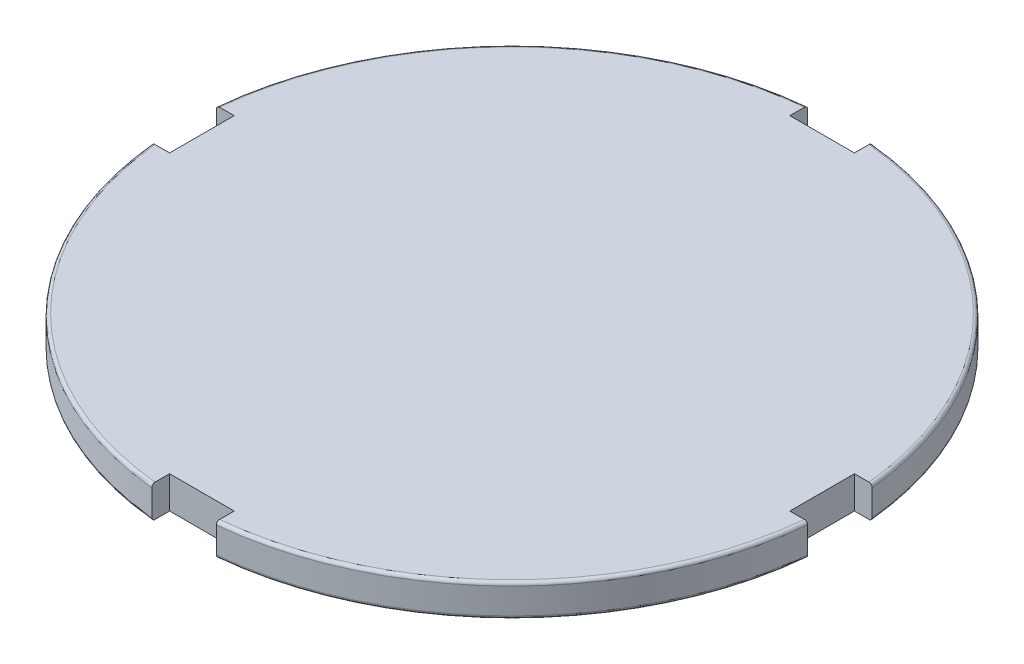
from build123d import *

# Parameters (mm, degrees)
SKETCH2_R           = 64.77
BOSS_EXTRUDE1_DEPTH = 6.35
FILLET1_R           = 0.635
SKETCH4_W           = 13.950963387
SKETCH4_H           = 12.7
SKETCH4_W_2         = 12.7
SKETCH4_H_2         = 13.950963387
CUT_EXTRUDE1_DEPTH  = 92.818453009


with BuildPart() as part:
    # Sketch2 → Boss-Extrude1 (new body)
    with BuildSketch(Plane(origin=(0, 0, 0), x_dir=(1, 0, 0), z_dir=(0, 1, 0))):
        with Locations(Location((0, 0, 0), (0, 0, 270))):
            Circle(SKETCH2_R)
    extrude(amount=BOSS_EXTRUDE1_DEPTH)

    # Fillet1
    fillet1_edges = [part.edges().sort_by_distance(p)[0] for p in [
        (0, 0, -64.77),
        (0, 6.35, -64.77),
    ]]
    fillet(fillet1_edges, radius=FILLET1_R)

    # Sketch4 → Cut-Extrude1 (cut, through all)
    with BuildSketch(Plane.XZ):
        with Locations((67.935481694, 0)):
            Rectangle(SKETCH4_W, SKETCH4_H)
        with Locations((0, -67.935481694)):
            Rectangle(SKETCH4_W_2, SKETCH4_H_2)
        with Locations((-67.935481694, 0)):
            Rectangle(SKETCH4_W, SKETCH4_H)
        with Locations((0, 67.935481694)):
            Rectangle(SKETCH4_W_2, SKETCH4_H_2)
    extrude(amount=-CUT_EXTRUDE1_DEPTH, mode=Mode.SUBTRACT)


solid = part.part
